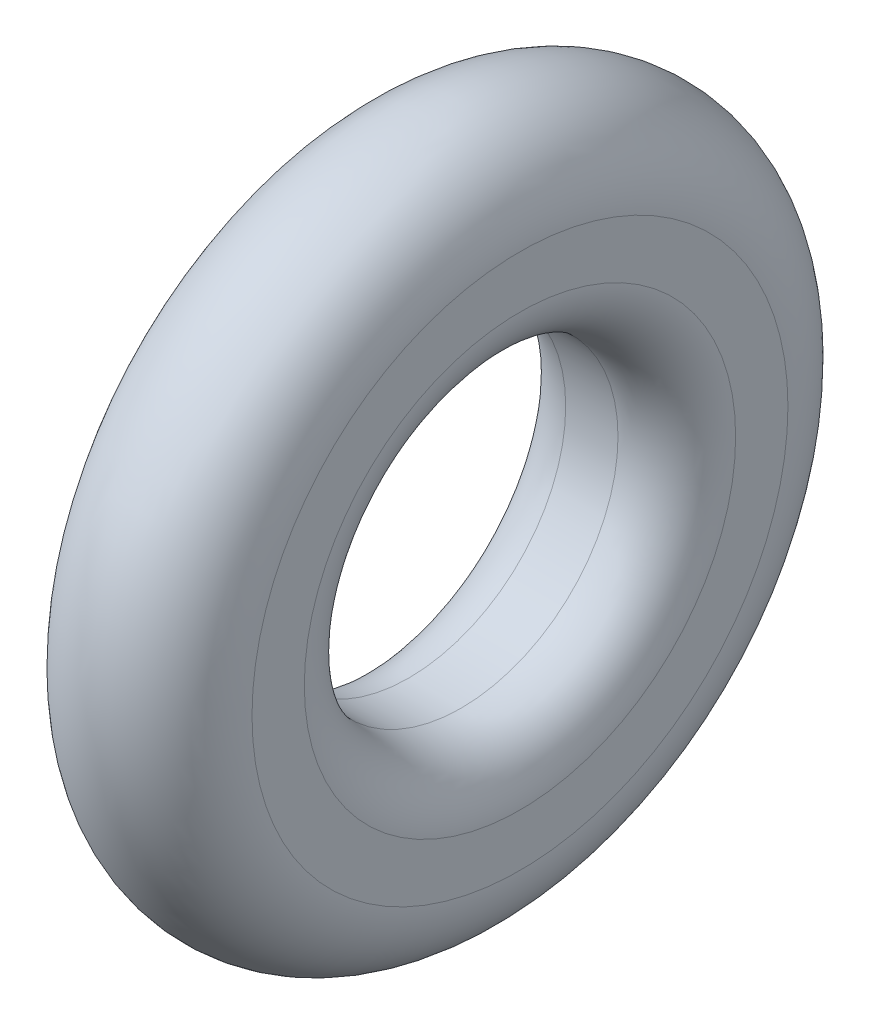
from build123d import *


with BuildPart() as part:
    # Sketch1 → Revolve1 (revolve)
    with BuildSketch(Plane.XY, mode=Mode.PRIVATE) as revolve1_sk:
        with BuildLine():
            Line((-0.5, 3), (0.5, 3))
            ThreePointArc((0.5, 3), (1.295495129, 3.329504871), (1.625, 4.125))
            Line((1.625, 4.125), (1.625, 5.125))
            ThreePointArc((1.625, 5.125), (0, 6.75), (-1.625, 5.125))
            Line((-1.625, 5.125), (-1.625, 4.125))
            ThreePointArc((-1.625, 4.125), (-1.295495129, 3.329504871), (-0.5, 3))
        make_face()
    revolve(revolve1_sk.sketch.rotate(Axis((0, 0, 0), (-1, 0, 0)), 90), axis=Axis((0, 0, 0), (-1, 0, 0)))


solid = part.part
